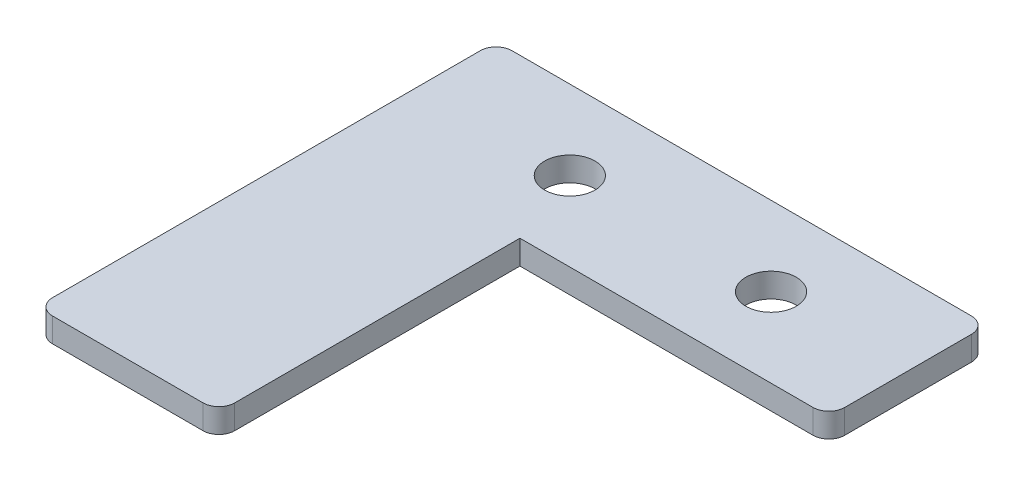
from build123d import *

# Parameters (mm, degrees)
SKETCH1_R           = 1.59
BOSS_EXTRUDE1_DEPTH = 1.524
FILLET1_R           = 1


with BuildPart() as part:
    # Sketch1 → Boss-Extrude1 (new body)
    with BuildSketch(Plane(origin=(0, 0, 0), x_dir=(1, 0, 0), z_dir=(0, 1, 0))):
        Polygon((-9.65, 5), (-9.65, -24), (1.85, -24), (1.85, -5), (21.35, -5), (21.35, 5), align=None)
        with Locations(Location((0, 0, 0), (0, 0, 90))):
            Circle(SKETCH1_R, mode=Mode.SUBTRACT)
        with Locations(Location((12.7, 0, 0), (0, 0, 90))):
            Circle(SKETCH1_R, mode=Mode.SUBTRACT)
    extrude(amount=BOSS_EXTRUDE1_DEPTH)

    # Fillet1
    fillet1_edges = [part.edges().sort_by_distance(p)[0] for p in [
        (-9.65, 0.762, -5),
        (21.35, 0.762, -5),
        (21.35, 0.762, 5),
        (1.85, 0.762, 24),
        (-9.65, 0.762, 24),
    ]]
    fillet(fillet1_edges, radius=FILLET1_R)


solid = part.part
